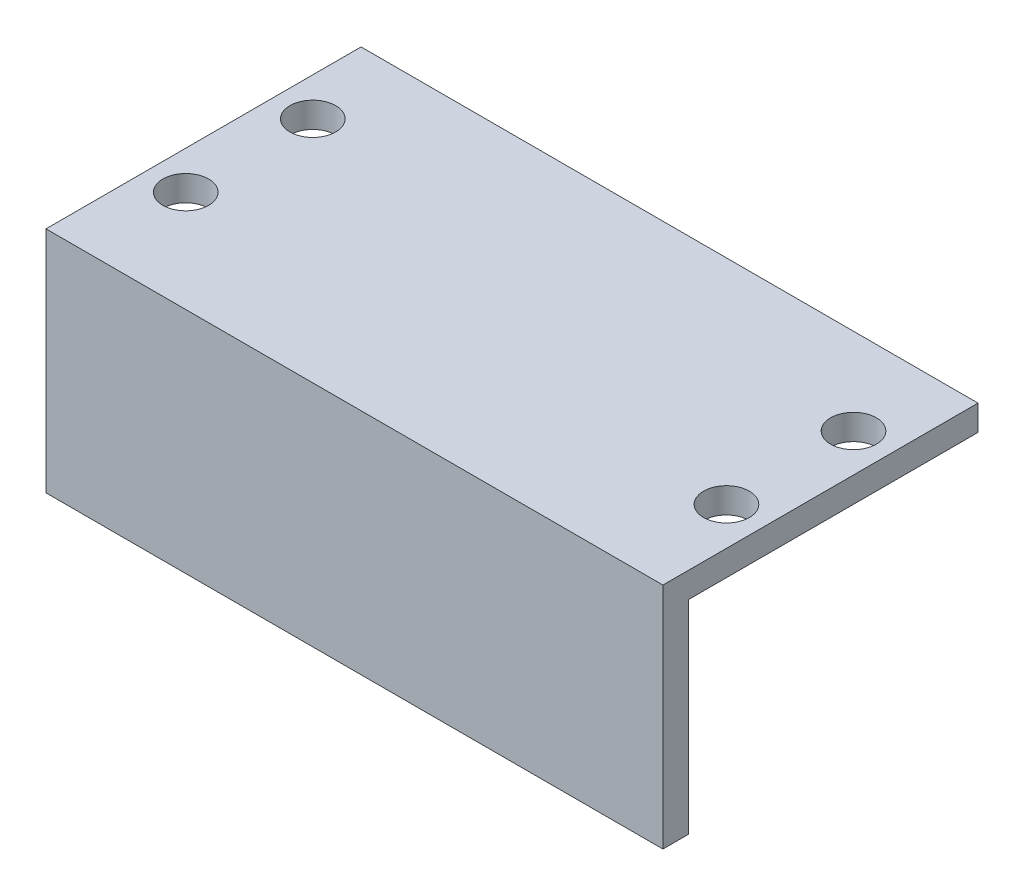
from build123d import *

# Parameters (mm, degrees)
SKETCH1_W                = 24.28
SKETCH1_H                = 11.4
SKETCH1_R                = 0.9
BOSS_EXTRUDE1_DEPTH      = 1
BOSS_EXTRUDE2_DEPTH      = 1
BOSS_EXTRUDE2_DEPTH_BACK = 8
SKETCH1_3_W              = 24.28
SKETCH1_3_H              = 1


with BuildPart() as part:
    # Sketch1 → Boss-Extrude1 (new body)
    with BuildSketch(Plane(origin=(0, 0, 0), x_dir=(1, 0, 0), z_dir=(0, 1, 0))):
        with Locations((12.14, 5.7)):
            Rectangle(SKETCH1_W, SKETCH1_H)
        with Locations((22.78, 3)):
            Circle(SKETCH1_R, mode=Mode.SUBTRACT)
        with Locations((22.78, 8)):
            Circle(SKETCH1_R, mode=Mode.SUBTRACT)
        with Locations((1.5, 8)):
            Circle(SKETCH1_R, mode=Mode.SUBTRACT)
        with Locations((1.5, 3)):
            Circle(SKETCH1_R, mode=Mode.SUBTRACT)
    extrude(amount=BOSS_EXTRUDE1_DEPTH)

    # Sketch1<3> → Boss-Extrude2 (add, two sides: drawn at the far end of the back side and taken through both)
    with BuildSketch(Plane(origin=(0, 0, 0), x_dir=(1, 0, 0), z_dir=(0, 1, 0)).offset(-BOSS_EXTRUDE2_DEPTH_BACK)):
        with Locations((12.14, -0.5)):
            Rectangle(SKETCH1_3_W, SKETCH1_3_H)
    extrude(amount=BOSS_EXTRUDE2_DEPTH + BOSS_EXTRUDE2_DEPTH_BACK)


solid = part.part
